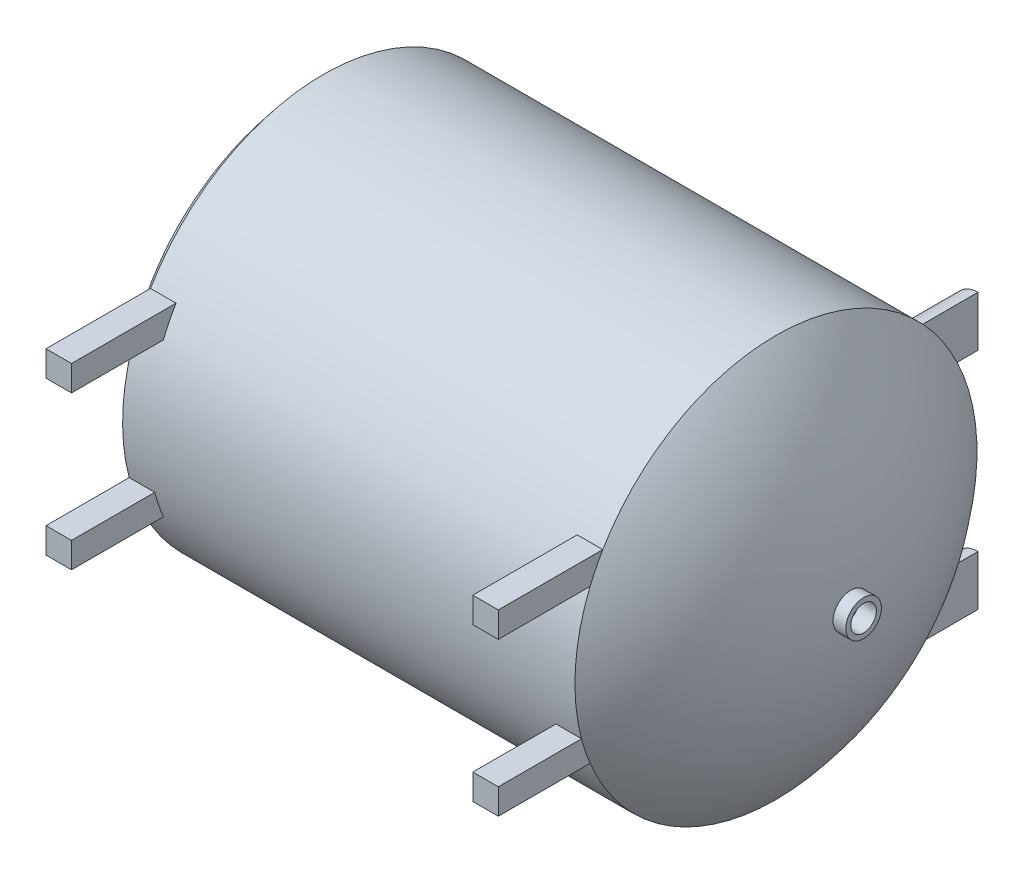
from build123d import *

# Parameters (mm, degrees)
BOSS_EXTRUDE1_REACH      = 1519.328
BOSS_EXTRUDE1_END_RADIUS = 400
BOSS_EXTRUDE2_REACH      = 1605.109
BOSS_EXTRUDE2_END_RADIUS = 400
SKETCH5_W                = 50.8
SKETCH5_H                = 50.8


with BuildPart() as part:
    # Sketch1 → Revolve1 (revolve)
    with BuildSketch(Plane.XY):
        with BuildLine():
            Line((150, -400), (1050, -400))
            ThreePointArc((1050, -400), (1154.808037789, -230.089635957), (1198.969132037, -35.4))
            Line((1198.969132037, -35.4), (1224.369132037, -35.4))
            Line((1224.369132037, -35.4), (1224.369132037, -25.4))
            Line((1224.369132037, -25.4), (1199.469500194, -25.4))
            Line((1199.469500194, -25.4), (1189.460625969, -25.4))
            ThreePointArc((1189.460625969, -25.4), (1148.153333745, -219.830314428), (1045.431779669, -390))
            Line((1045.431779669, -390), (154.568220331, -390))
            ThreePointArc((154.568220331, -390), (47.305004997, -207.966325597), (10, 0))
            Line((10, 0), (0, 0))
            ThreePointArc((0, 0), (38.733083645, -213.600093633), (150, -400))
        make_face()
    revolve(axis=Axis((0, 0, 0), (1, 0, 0)))

    # Boss-Extrude1: up to this cylinder (the profile starts outside it)
    boss_extrude1_end = Plane(origin=(1028.779341, 0, 0), z_dir=(-1, 0, 0)) * Cylinder(BOSS_EXTRUDE1_END_RADIUS, 3839.656, mode=Mode.PRIVATE)
    # Sketch4 → Boss-Extrude1 (add, up to the surface)
    with BuildSketch(Plane(origin=(0, 0, -402), x_dir=(-1, 0, 0), z_dir=(0, 0, -1)), mode=Mode.PRIVATE) as boss_extrude1_sk1:
        with BuildLine():
            Line((-1050, 173.312071556), (-1050, 273.312071556))
            ThreePointArc((-1050, 273.312071556), (-1000, 223.312071556), (-1050, 173.312071556))
        make_face()
    boss_extrude1_tool1 = extrude(boss_extrude1_sk1.sketch, amount=-BOSS_EXTRUDE1_REACH, mode=Mode.PRIVATE) - boss_extrude1_end
    add(boss_extrude1_tool1.solids().sort_by_distance((1028.779341, 223.312072, -402))[0])
    # Sketch4 → Boss-Extrude1 (add, up to the surface)
    with BuildSketch(Plane(origin=(0, 0, -402), x_dir=(-1, 0, 0), z_dir=(0, 0, -1)), mode=Mode.PRIVATE) as boss_extrude1_sk2:
        with BuildLine():
            Line((-1050, -173.312071556), (-1050, -273.312071556))
            ThreePointArc((-1050, -273.312071556), (-1000, -223.312071556), (-1050, -173.312071556))
        make_face()
    boss_extrude1_tool2 = extrude(boss_extrude1_sk2.sketch, amount=-BOSS_EXTRUDE1_REACH, mode=Mode.PRIVATE) - boss_extrude1_end
    add(boss_extrude1_tool2.solids().sort_by_distance((1028.779341, -223.312072, -402))[0])

    # Boss-Extrude2: up to this cylinder (the profile starts outside it)
    boss_extrude2_end = Plane(origin=(600, 0, 0), z_dir=(-1, 0, 0)) * Cylinder(BOSS_EXTRUDE2_END_RADIUS, 4860.418, mode=Mode.PRIVATE)
    # Sketch5 → Boss-Extrude2 (add, up to the surface)
    with BuildSketch(Plane.XY.offset(552.4), mode=Mode.PRIVATE) as boss_extrude2_sk1:
        with Locations((1024.6, 177.8)):
            Rectangle(SKETCH5_W, SKETCH5_H)
    boss_extrude2_tool1 = extrude(boss_extrude2_sk1.sketch, amount=-BOSS_EXTRUDE2_REACH, mode=Mode.PRIVATE) - boss_extrude2_end
    add(boss_extrude2_tool1.solids().sort_by_distance((1024.6, 177.8, 552.4))[0])
    # Sketch5 → Boss-Extrude2 (add, up to the surface)
    with BuildSketch(Plane.XY.offset(552.4), mode=Mode.PRIVATE) as boss_extrude2_sk2:
        with Locations((175.4, 177.8)):
            Rectangle(SKETCH5_W, SKETCH5_H)
    boss_extrude2_tool2 = extrude(boss_extrude2_sk2.sketch, amount=-BOSS_EXTRUDE2_REACH, mode=Mode.PRIVATE) - boss_extrude2_end
    add(boss_extrude2_tool2.solids().sort_by_distance((175.4, 177.8, 552.4))[0])
    # Sketch5 → Boss-Extrude2 (add, up to the surface)
    with BuildSketch(Plane.XY.offset(552.4), mode=Mode.PRIVATE) as boss_extrude2_sk3:
        with Locations((1024.6, -127)):
            Rectangle(SKETCH5_W, SKETCH5_H)
    boss_extrude2_tool3 = extrude(boss_extrude2_sk3.sketch, amount=-BOSS_EXTRUDE2_REACH, mode=Mode.PRIVATE) - boss_extrude2_end
    add(boss_extrude2_tool3.solids().sort_by_distance((1024.6, -127, 552.4))[0])
    # Sketch5 → Boss-Extrude2 (add, up to the surface)
    with BuildSketch(Plane.XY.offset(552.4), mode=Mode.PRIVATE) as boss_extrude2_sk4:
        with Locations((175.4, -127)):
            Rectangle(SKETCH5_W, SKETCH5_H)
    boss_extrude2_tool4 = extrude(boss_extrude2_sk4.sketch, amount=-BOSS_EXTRUDE2_REACH, mode=Mode.PRIVATE) - boss_extrude2_end
    add(boss_extrude2_tool4.solids().sort_by_distance((175.4, -127, 552.4))[0])


solid = part.part
